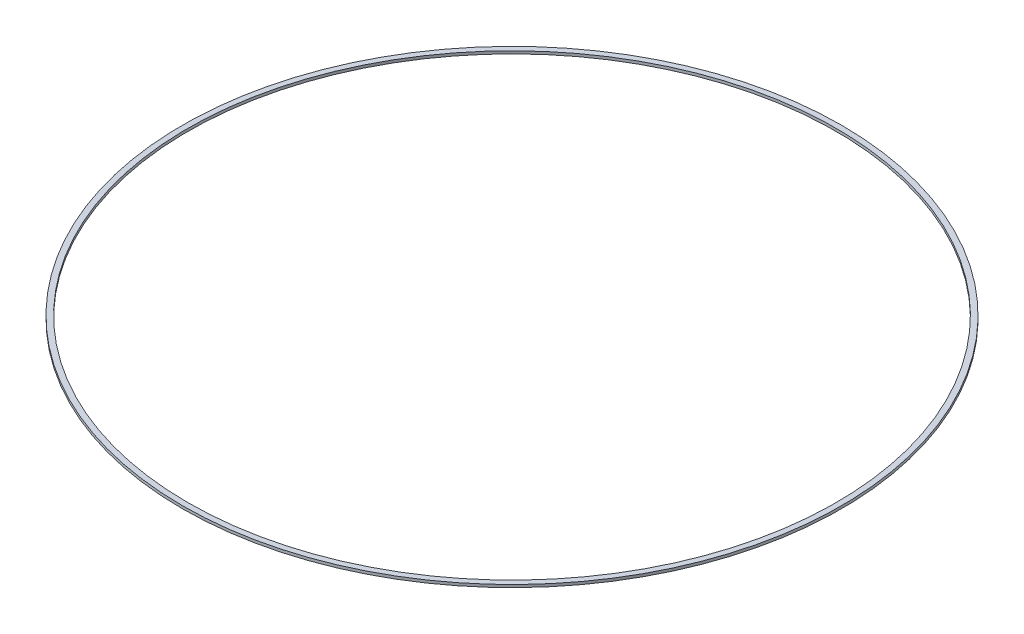
from build123d import *

# Parameters (mm, degrees)
SKETCH1_R           = 154.94
SKETCH1_R_2         = 152.4
BOSS_EXTRUDE1_DEPTH = 1.27


with BuildPart() as part:
    # Sketch1 → Boss-Extrude1 (new body)
    with BuildSketch(Plane(origin=(0, 0, 0), x_dir=(1, 0, 0), z_dir=(0, 1, 0))):
        with Locations(Location((-43.568394907, -20.906981448, 0), (0, 0, 270))):
            Circle(SKETCH1_R)
        with Locations(Location((-43.568394907, -20.906981448, 0), (0, 0, 270))):
            Circle(SKETCH1_R_2, mode=Mode.SUBTRACT)
    extrude(amount=BOSS_EXTRUDE1_DEPTH)


solid = part.part
